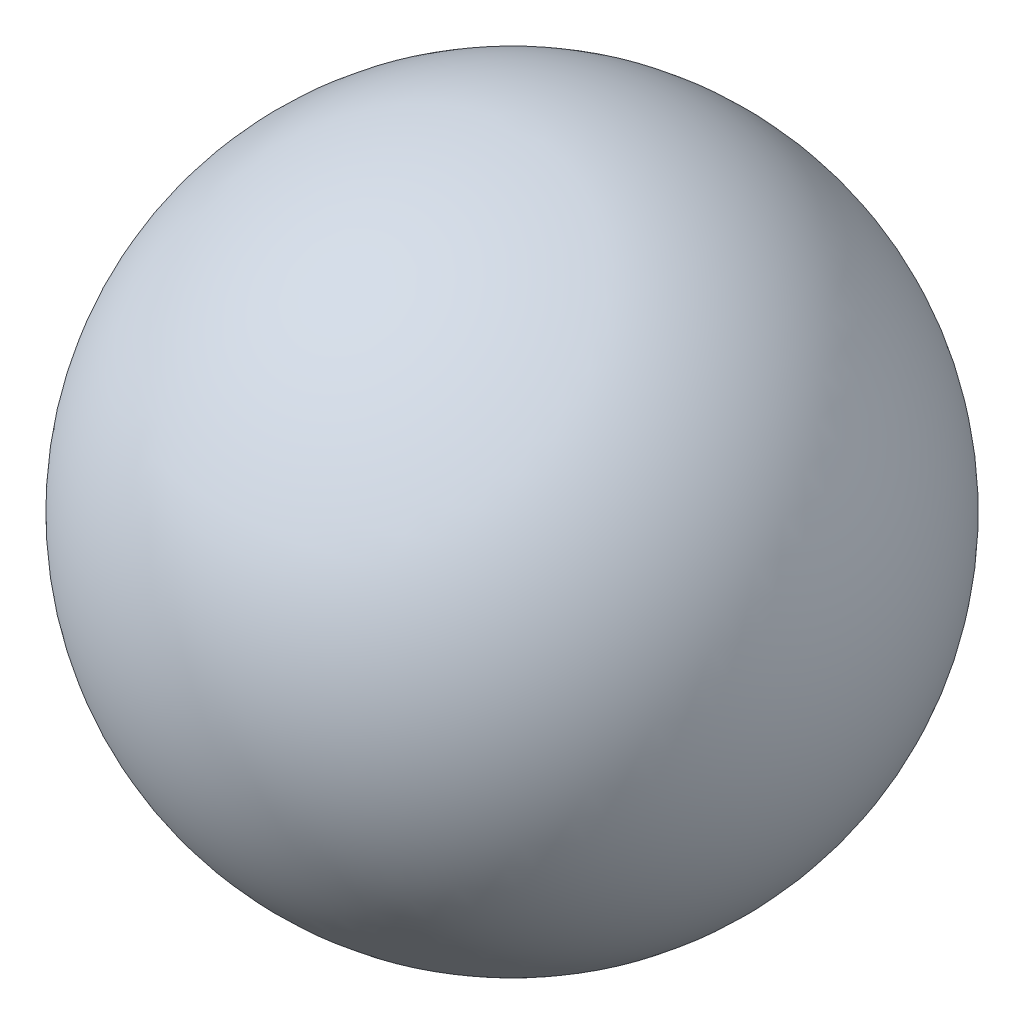
from build123d import *


with BuildPart() as part:
    # ｽｹｯﾁ1 → 回転1 (revolve)
    with BuildSketch(Plane.XY):
        with BuildLine():
            Line((0, 1.985), (0, -1.985))
            ThreePointArc((0, -1.985), (1.985, 0), (0, 1.985))
        make_face()
    revolve(axis=Axis((0, 1.985, 0), (0, -1, 0)))


solid = part.part
